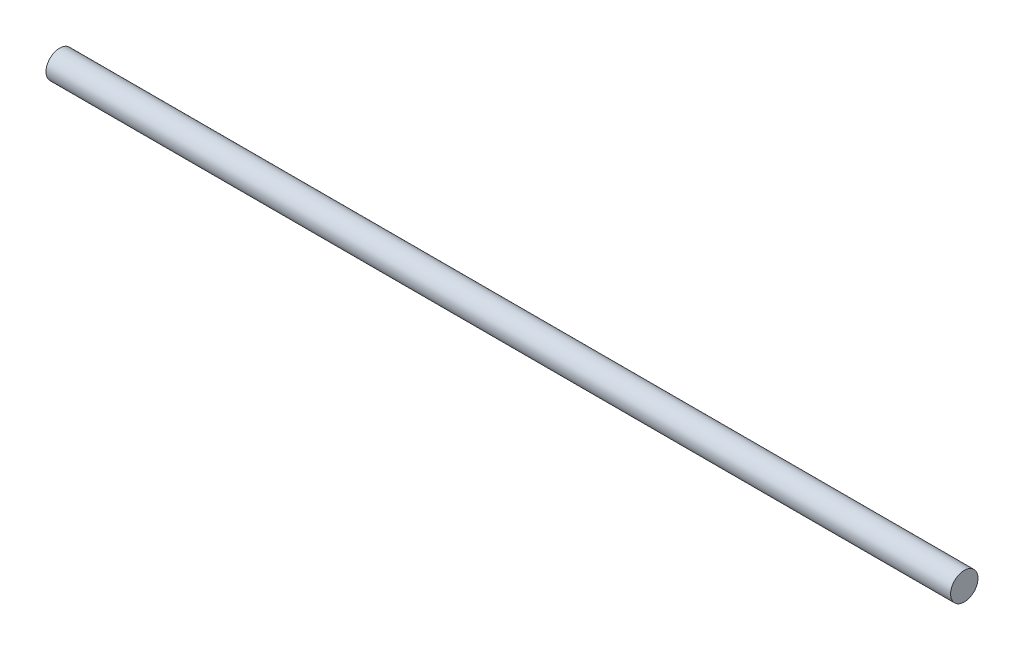
from build123d import *

# Parameters (mm, degrees)
SKETCH2_R           = 3.175
BOSS_EXTRUDE1_DEPTH = 209.55


with BuildPart() as part:
    # Sketch2 → Boss-Extrude1 (new body)
    with BuildSketch(Plane(origin=(0, 0, 0), x_dir=(0, 0, -1), z_dir=(1, 0, 0))):
        Circle(SKETCH2_R)
    extrude(amount=BOSS_EXTRUDE1_DEPTH)


solid = part.part
